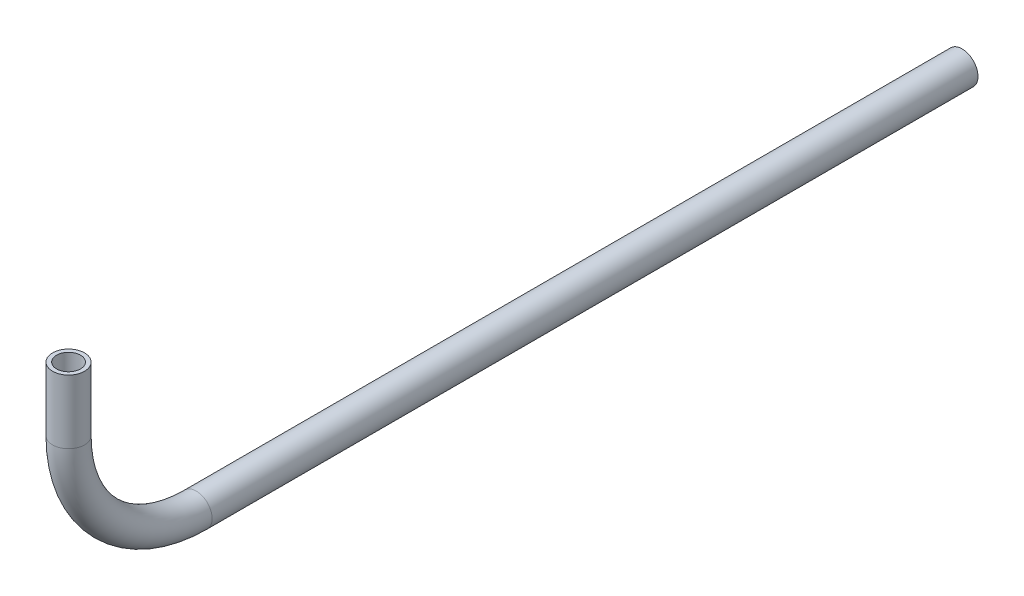
from build123d import *

# Parameters (mm, degrees)
SWEEP1_PROFILE_R     = 6.35
CUT_SWEEP1_PROFILE_R = 4.7625


with BuildPart() as part:
    # Sweep1: sweep along a curve in space
    with BuildLine() as sweep1_path:
        Line((0, 0, 0), (0, 0, 304.8))
        ThreePointArc((0, 0, 304.8), (0, 14.878975516, 340.721024484), (0, 50.8, 355.6))
        Line((0, 50.8, 355.6), (0, 76.2, 355.6))
    # Sweep1 profile (on start of the path) → Sweep1 (sweep)
    with BuildSketch(Plane.XY):
        Circle(SWEEP1_PROFILE_R)
    sweep(path=sweep1_path.line)

    # Cut-Sweep1: sweep along a curve in space
    with BuildLine() as cut_sweep1_path:
        Line((0, 0, 0), (0, 0, 304.8))
        ThreePointArc((0, 0, 304.8), (0, 14.878975516, 340.721024484), (0, 50.8, 355.6))
        Line((0, 50.8, 355.6), (0, 76.2, 355.6))
    # Cut-Sweep1 profile (on start of the path) → Cut-Sweep1 (sweep, cut)
    with BuildSketch(Plane.XY):
        Circle(CUT_SWEEP1_PROFILE_R)
    sweep(path=cut_sweep1_path.line, mode=Mode.SUBTRACT)


solid = part.part
